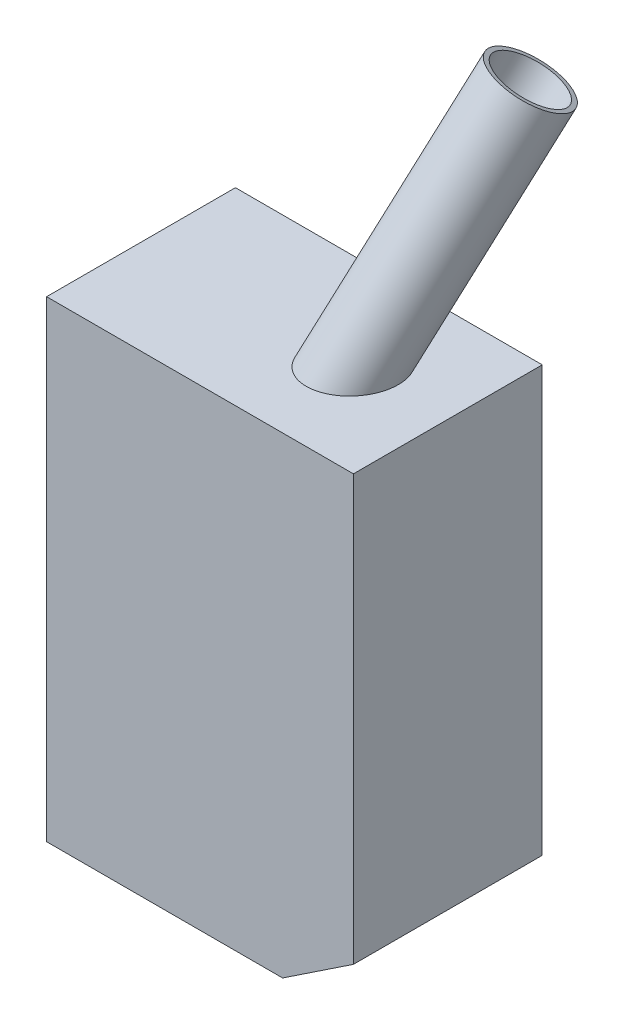
from build123d import *

# Parameters (mm, degrees)
SKETCH1_W                       = 165.1
SKETCH1_H                       = 101.6
BOSS_EXTRUDE1_DEPTH             = 254
CUT_EXTRUDE1_DEPTH              = 254
SKETCH5_R                       = 20.447
BOSS_EXTRUDE3_DEPTH             = 139.7
BOSS_EXTRUDE3_DIRECTION_2_REACH = 285.127
SHELL2_T                        = -2.54


with BuildPart() as part:
    # Sketch1 → Boss-Extrude1 (new body)
    with BuildSketch(Plane(origin=(0, 0, 0), x_dir=(1, 0, 0), z_dir=(0, 1, 0))):
        Rectangle(SKETCH1_W, SKETCH1_H)
    extrude(amount=BOSS_EXTRUDE1_DEPTH)

    # Sketch2 → Cut-Extrude1 (cut)
    with BuildSketch(Plane(origin=(0, 0, -50.8), x_dir=(-1, 0, 0), z_dir=(0, 0, -1))):
        Polygon((-44.45, 0), (-82.55, 25.4), (-82.55, 0), align=None)
    extrude(amount=-CUT_EXTRUDE1_DEPTH, mode=Mode.SUBTRACT)

    # Sketch5 → Boss-Extrude3 (add)
    with BuildSketch(Plane(origin=(31.75, 254, 0), x_dir=(0.9657919899307167, -0.2399824072752947, 0.09825617733263003), z_dir=(0.2588190451025181, 0.8685657757104482, -0.422618261740697))):
        with Locations(Location((0, 0, 0), (0, 0, 269.046198917))):
            Circle(SKETCH5_R)
    extrude(amount=BOSS_EXTRUDE3_DEPTH)

    # Boss-Extrude3 direction 2: up to this face of the body (flat: up to its plane)
    boss_extrude3_direction_2_end = Plane(part.part.faces().sort_by_distance((0, 254, 0))[0])
    # Sketch5 → Boss-Extrude3 direction 2 (add, up to the picked face)
    with BuildSketch(Plane(origin=(31.75, 254, 0), x_dir=(0.9657919899307167, -0.2399824072752947, 0.09825617733263003), z_dir=(0.2588190451025181, 0.8685657757104482, -0.422618261740697)), mode=Mode.PRIVATE) as boss_extrude3_direction_2_sk1:
        with Locations(Location((0, 0, 0), (0, 0, 269.046198917))):
            Circle(SKETCH5_R)
    boss_extrude3_direction_2_tool1 = split(extrude(boss_extrude3_direction_2_sk1.sketch, amount=-BOSS_EXTRUDE3_DIRECTION_2_REACH, mode=Mode.PRIVATE), bisect_by=boss_extrude3_direction_2_end, keep=Keep.BOTH, mode=Mode.PRIVATE)
    add(boss_extrude3_direction_2_tool1.solids().sort_by(Axis((31.75, 254, 0), (-0.2588190451025181, -0.8685657757104482, 0.422618261740697)))[0])

    # Shell2
    shell2_openings = [part.faces().sort_by_distance(p)[0] for p in [
        (67.907020601, 375.338638867, -59.039771165),
    ]]
    offset(amount=SHELL2_T, openings=shell2_openings, kind=Kind.INTERSECTION)


solid = part.part
